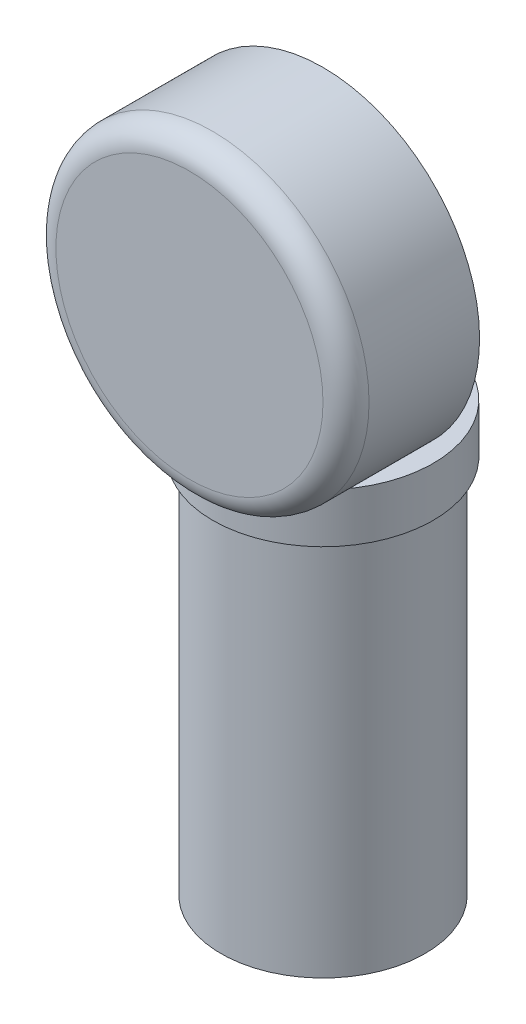
from build123d import *

# Parameters (mm, degrees)
SKETCH1_R      = 8.636
EXTRUDE1_DEPTH = 7.366
FILLET1_R      = 1.27
SKETCH2_W      = 6.080205461
SKETCH2_H      = 2.724463649
SKETCH3_R      = 5.626834032
EXTRUDE2_DEPTH = 20.922880412


with BuildPart() as part:
    # Sketch1 → Extrude1 (new body)
    with BuildSketch(Plane.XY):
        with Locations((-6.272807724, -26.314359982)):
            Circle(SKETCH1_R)
    extrude(amount=EXTRUDE1_DEPTH)

    # Fillet1
    fillet1_edges = [part.edges().sort_by_distance(p)[0] for p in [
        (-14.908807724, -26.314359982, 7.366),
    ]]
    fillet(fillet1_edges, radius=FILLET1_R)

    # Sketch2 → Revolve1 (revolve)
    with BuildSketch(Plane.XY, mode=Mode.PRIVATE) as revolve1_sk:
        with Locations((-9.312910455, -34.919678092)):
            Rectangle(SKETCH2_W, SKETCH2_H)
    revolve(revolve1_sk.sketch.rotate(Axis((-6.272807724, -33.557446268, 0), (0, -1, 0)), 270), axis=Axis((-6.272807724, -33.557446268, 0), (0, -1, 0)))

    # Sketch3 → Extrude2 (add)
    with BuildSketch(Plane.XZ.offset(36.281909917)):
        with Locations(Location((-6.272807724, 0, 0), (0, 0, 270))):
            Circle(SKETCH3_R)
    extrude(amount=EXTRUDE2_DEPTH)


solid = part.part
